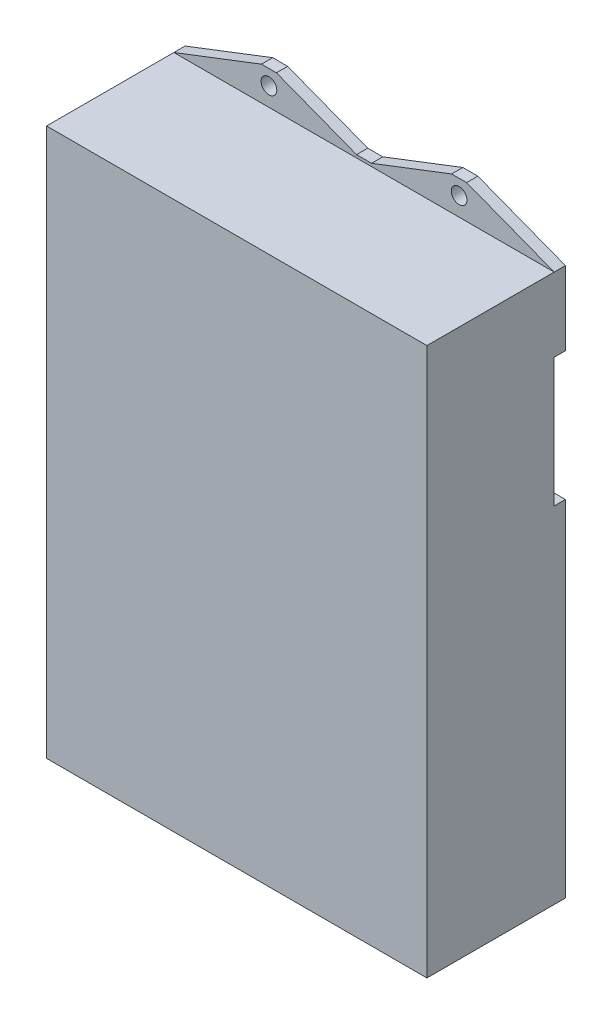
from build123d import *

# Parameters (mm, degrees)
ESQUISSE1_R        = 2.1
ESQUISSE1_R_2      = 1.5
BOSS_EXTRU_1_DEPTH = 3
ESQUISSE2_W        = 101.6
ESQUISSE2_H        = 146.3
BOSS_EXTRU_2_DEPTH = 34


with BuildPart() as part:
    # Esquisse1 → Boss.-Extru.1 (new body)
    with BuildSketch(Plane.XY):
        Polygon((-50.8, 73.15), (-27.4, 82.15), (-23.4, 82.15), (-2, 73.919230769), (2, 73.919230769), (23.4, 82.15), (27.4, 82.15), (50.8, 73.15), (50.8, 53.45), (43.2, 53.45), (43.2, 19.05), (50.8, 19.05), (50.8, -73.15), (27.4, -82.15), (23.4, -82.15), (2, -73.919230769), (-2, -73.919230769), (-23.4, -82.15), (-27.4, -82.15), (-50.8, -73.15), (-50.8, 19.05), (-43.2, 19.05), (-43.2, 53.45), (-50.8, 53.45), align=None)
        with Locations((-25.4, -78.15)):
            Circle(ESQUISSE1_R, mode=Mode.SUBTRACT)
        with Locations(Location((25.4, -78.15, 0), (0, 0, 180))):
            Circle(ESQUISSE1_R, mode=Mode.SUBTRACT)
        with Locations(Location((-25.4, 78.15, 0), (0, 0, 180))):
            Circle(ESQUISSE1_R, mode=Mode.SUBTRACT)
        with Locations((25.4, 78.15)):
            Circle(ESQUISSE1_R, mode=Mode.SUBTRACT)
        with Locations((-48.1, -69.85)):
            Circle(ESQUISSE1_R_2, mode=Mode.SUBTRACT)
        with Locations(Location((48.1, -69.85, 0), (0, 0, 180))):
            Circle(ESQUISSE1_R_2, mode=Mode.SUBTRACT)
        with Locations(Location((-48.1, 69.85, 0), (0, 0, 180))):
            Circle(ESQUISSE1_R_2, mode=Mode.SUBTRACT)
        with Locations((48.1, 69.85)):
            Circle(ESQUISSE1_R_2, mode=Mode.SUBTRACT)
    extrude(amount=BOSS_EXTRU_1_DEPTH)

    # Esquisse2 → Boss.-Extru.2 (add)
    with BuildSketch(Plane.XY.offset(3)):
        Rectangle(ESQUISSE2_W, ESQUISSE2_H)
    extrude(amount=BOSS_EXTRU_2_DEPTH)


solid = part.part
